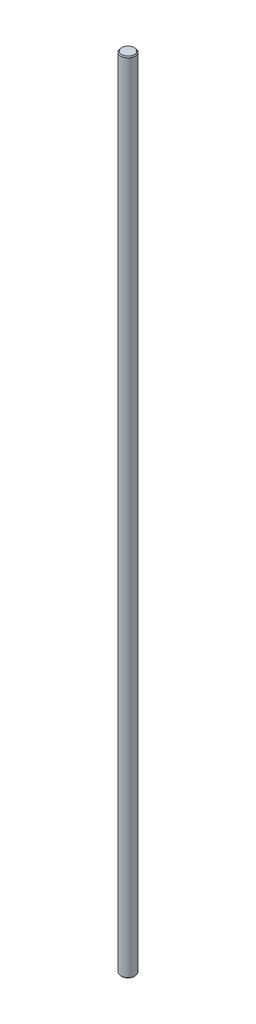
from build123d import *

# Parameters (mm, degrees)
CROQUIS1_R              = 4
SALIENTE_EXTRUIR1_DEPTH = 450
CHAFL_N1_SIZE           = 0.5


with BuildPart() as part:
    # Croquis1 → Saliente-Extruir1 (new body)
    with BuildSketch(Plane(origin=(0, 0, 0), x_dir=(1, 0, 0), z_dir=(0, 1, 0))):
        with Locations(Location((0, 0, 0), (0, 0, 270))):
            Circle(CROQUIS1_R)
    extrude(amount=SALIENTE_EXTRUIR1_DEPTH)

    # Chaflán1
    chafl_n1_edges = [part.edges().sort_by_distance(p)[0] for p in [
        (0, 0, -4),
        (0, 450, -4),
    ]]
    chamfer(chafl_n1_edges, length=CHAFL_N1_SIZE)


solid = part.part
